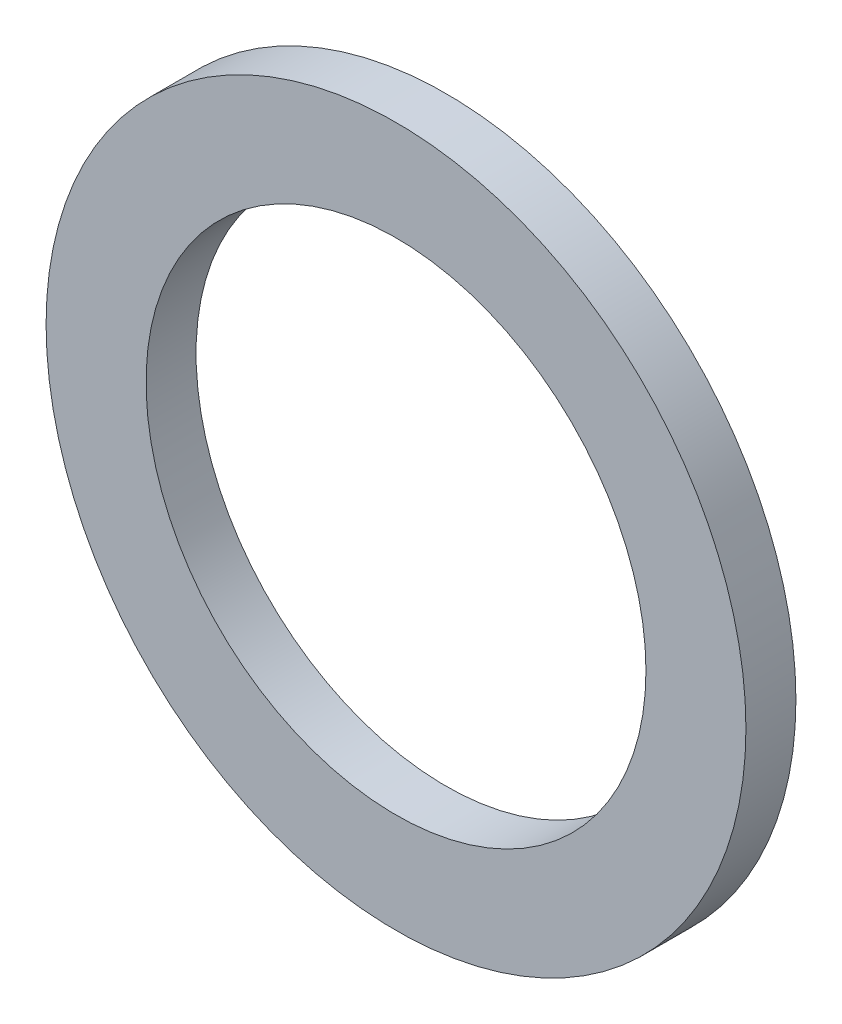
from build123d import *

# Parameters (mm, degrees)
SKETCH_1_R      = 3.5
SKETCH_1_R_2    = 2.5
EXTRUDE_1_DEPTH = 0.5


with BuildPart() as part:
    # 草图1 → 凸台-拉伸1 (new body)
    with BuildSketch(Plane.XY):
        Circle(SKETCH_1_R)
        Circle(SKETCH_1_R_2, mode=Mode.SUBTRACT)
    extrude(amount=EXTRUDE_1_DEPTH)


solid = part.part
